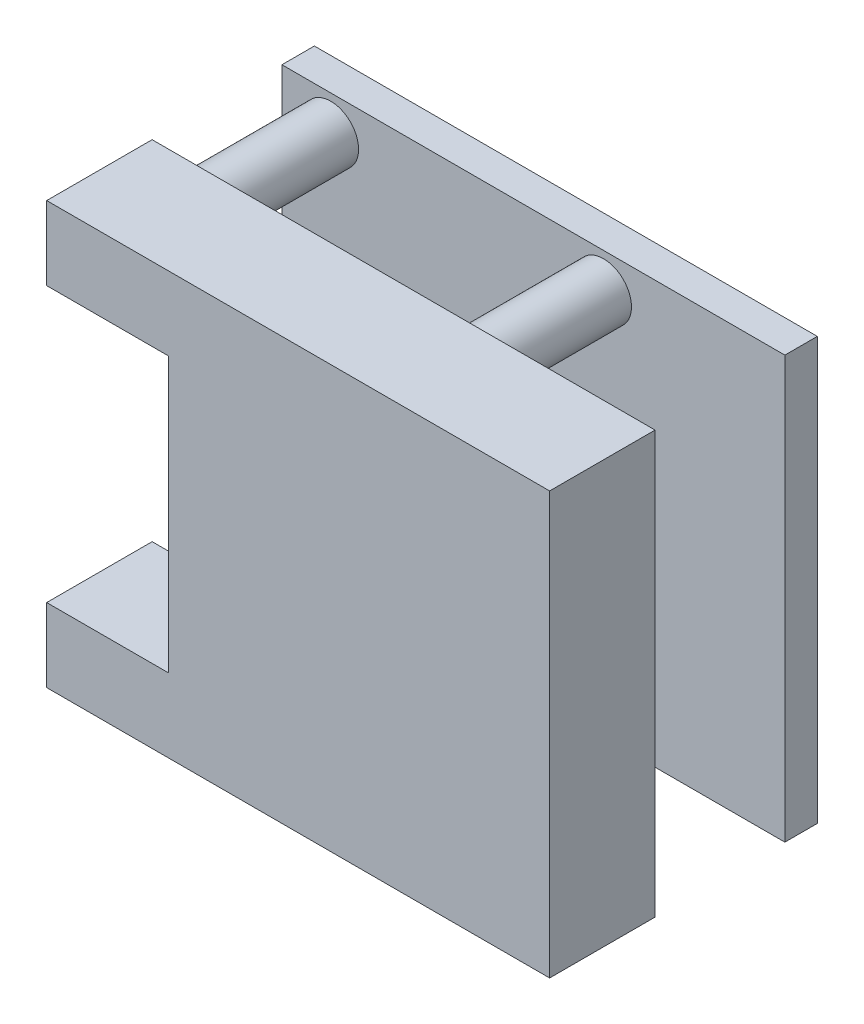
from build123d import *

# Parameters (mm, degrees)
SKETCH1_W           = 31
SKETCH1_H           = 26
BOSS_EXTRUDE1_DEPTH = 16.5
CUT_EXTRUDE1_START  = -6.5
SKETCH3_R           = 1.715784354
CUT_EXTRUDE1_DEPTH  = 8
SKETCH4_W           = 7.501797644
SKETCH4_H           = 16.91664374
CUT_EXTRUDE2_DEPTH  = 14.5


with BuildPart() as part:
    # Sketch1 → Boss-Extrude1 (new body)
    with BuildSketch(Plane.XY):
        with Locations((15.5, 13)):
            Rectangle(SKETCH1_W, SKETCH1_H)
    extrude(amount=BOSS_EXTRUDE1_DEPTH)

    # Sketch3 → Cut-Extrude1 (cut)
    with BuildSketch(Plane.XY.offset(16.5).offset(CUT_EXTRUDE1_START)):
        Polygon((0, 0), (0, 4.632335589), (6.323496347, 4.632335589), (6.323496347, 21.367664411), (0, 21.367664411), (0, 26), (31, 26), (31, 0), align=None)
        with Locations((3.010252107, 2.158101323)):
            Circle(SKETCH3_R, mode=Mode.SUBTRACT)
        with Locations((19.83045716, 2.158101323)):
            Circle(SKETCH3_R, mode=Mode.SUBTRACT)
        with Locations(Location((3.010252107, 23.841898677, 0), (0, 0, 180))):
            Circle(SKETCH3_R, mode=Mode.SUBTRACT)
        with Locations(Location((19.83045716, 23.841898677, 0), (0, 0, 180))):
            Circle(SKETCH3_R, mode=Mode.SUBTRACT)
    extrude(amount=-CUT_EXTRUDE1_DEPTH, mode=Mode.SUBTRACT)

    # Sketch4 → Cut-Extrude2 (cut)
    with BuildSketch(Plane.XY.offset(16.5)):
        with Locations((3.750898822, 13)):
            Rectangle(SKETCH4_W, SKETCH4_H)
    extrude(amount=-CUT_EXTRUDE2_DEPTH, mode=Mode.SUBTRACT)


solid = part.part
